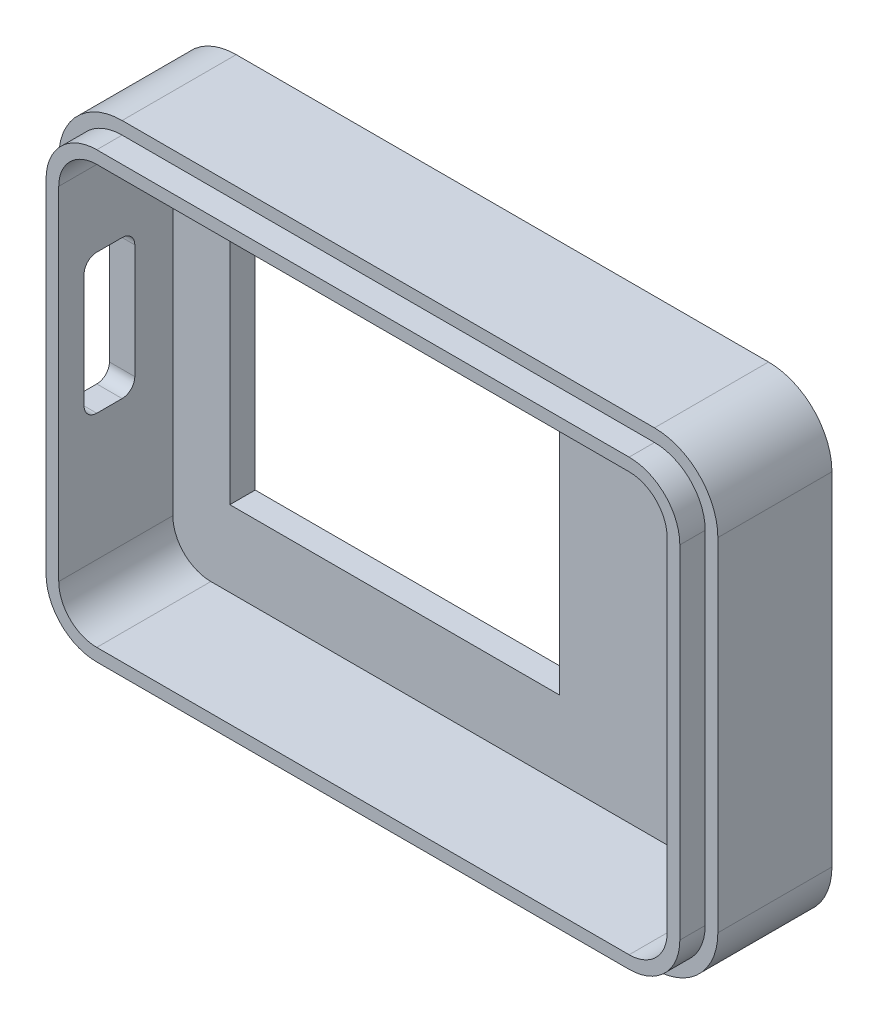
from build123d import *

# Parameters (mm, degrees)
BOSS_EXTRU_1_DEPTH      = 11
COQUE5_T                = -2
ESQUISSE5_W             = 26
ESQUISSE5_H             = 18
ENL_V_MAT_EXTRU_4_DEPTH = 65.451532177
ESQUISSE6_OUTSIDE_W     = 66.952
ESQUISSE6_OUTSIDE_H     = 51.952
ENL_V_MAT_EXTRU_5_DEPTH = 2
ENL_V_MAT_EXTRU_6_DEPTH = 10


with BuildPart() as part:
    # Esquisse1 → Boss.-Extru.1 (new body)
    with BuildSketch(Plane.XY):
        with BuildLine():
            Line((5, 0), (47, 0))
            ThreePointArc((47, 0), (50.535533906, 1.464466094), (52, 5))
            Line((52, 5), (52, 32))
            ThreePointArc((52, 32), (50.535533906, 35.535533906), (47, 37))
            Line((47, 37), (5, 37))
            ThreePointArc((5, 37), (1.464466094, 35.535533906), (0, 32))
            Line((0, 32), (0, 5))
            ThreePointArc((0, 5), (1.464466094, 1.464466094), (5, 0))
        make_face()
    extrude(amount=BOSS_EXTRU_1_DEPTH)

    # Coque5
    coque5_openings = [part.faces().sort_by_distance(p)[0] for p in [
        (26, 18.5, 11),
    ]]
    offset(amount=COQUE5_T, openings=coque5_openings, kind=Kind.INTERSECTION)

    # Esquisse5 → Enlèv. mat.-Extru.4 (cut, through all)
    with BuildSketch(Plane.XY.offset(2)):
        with Locations((19.5, 17)):
            Rectangle(ESQUISSE5_W, ESQUISSE5_H)
    extrude(amount=-ENL_V_MAT_EXTRU_4_DEPTH, mode=Mode.SUBTRACT)

    # Esquisse6 outside → Enlèv. mat.-Extru.5 (cut)
    with BuildSketch(Plane.XY.offset(11)):
        with Locations((26, 18.5)):
            Rectangle(ESQUISSE6_OUTSIDE_W, ESQUISSE6_OUTSIDE_H)
        with BuildLine():
            Line((47, 36), (5, 36))
            ThreePointArc((5, 36), (2.171572875, 34.828427125), (1, 32))
            Line((1, 32), (1, 5))
            ThreePointArc((1, 5), (2.171572875, 2.171572875), (5, 1))
            Line((5, 1), (47, 1))
            ThreePointArc((47, 1), (49.828427125, 2.171572875), (51, 5))
            Line((51, 5), (51, 32))
            ThreePointArc((51, 32), (49.828427125, 34.828427125), (47, 36))
        make_face(mode=Mode.SUBTRACT)
    extrude(amount=-ENL_V_MAT_EXTRU_5_DEPTH, mode=Mode.SUBTRACT)

    # Esquisse7 → Enlèv. mat.-Extru.6 (cut)
    with BuildSketch(Plane.ZY):
        with BuildLine():
            Line((6, 26), (8, 26))
            ThreePointArc((8, 26), (8.707106781, 25.707106781), (9, 25))
            Line((9, 25), (9, 16))
            ThreePointArc((9, 16), (8.707106781, 15.292893219), (8, 15))
            Line((8, 15), (6, 15))
            ThreePointArc((6, 15), (5.292893219, 15.292893219), (5, 16))
            Line((5, 16), (5, 25))
            ThreePointArc((5, 25), (5.292893219, 25.707106781), (6, 26))
        make_face()
    extrude(amount=-ENL_V_MAT_EXTRU_6_DEPTH, mode=Mode.SUBTRACT)


solid = part.part
